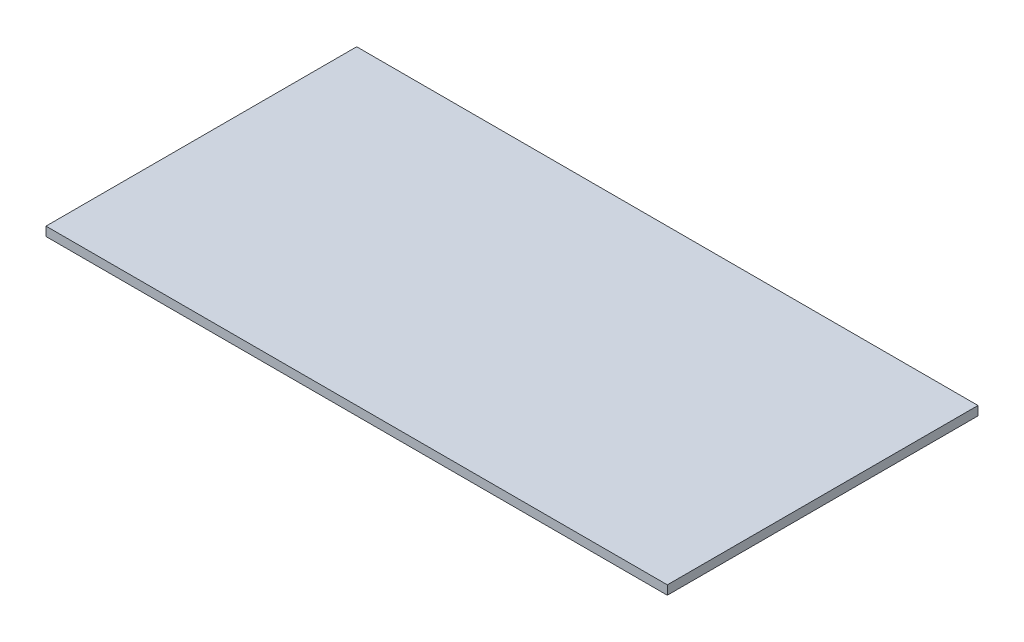
from build123d import *

# Parameters (mm, degrees)
SKETCH1_W           = 110
SKETCH1_H           = 55
BOSS_EXTRUDE1_DEPTH = 1.6


with BuildPart() as part:
    # Sketch1 → Boss-Extrude1 (new body)
    with BuildSketch(Plane(origin=(0, 0, 0), x_dir=(1, 0, 0), z_dir=(0, 1, 0))):
        with Locations((55, 27.5)):
            Rectangle(SKETCH1_W, SKETCH1_H)
    extrude(amount=BOSS_EXTRUDE1_DEPTH)


solid = part.part
